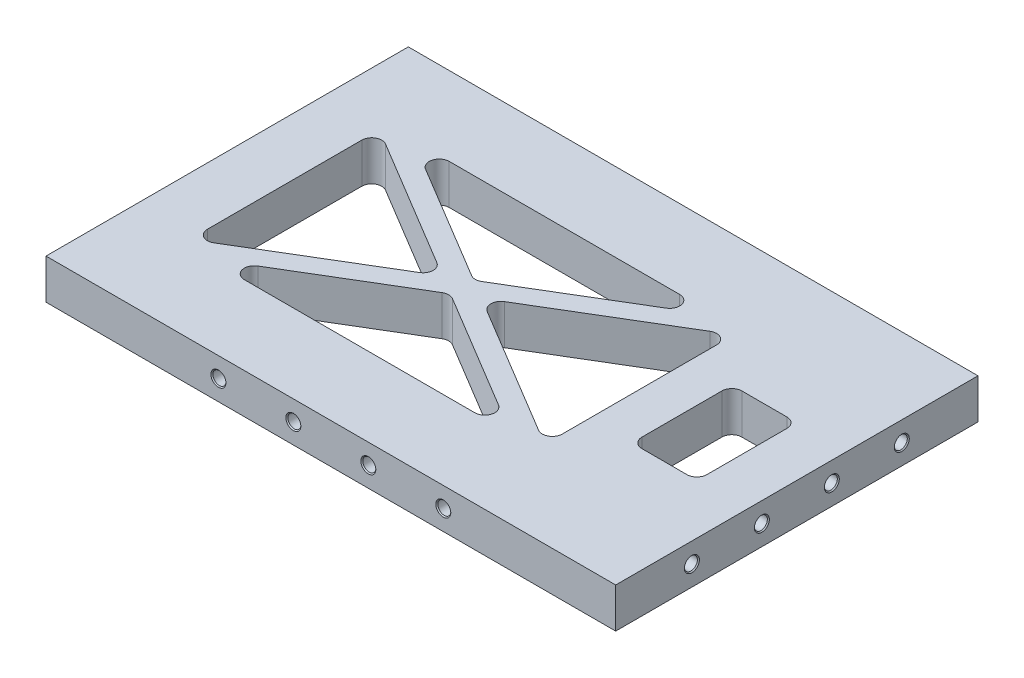
from build123d import *

# Parameters (mm, degrees)
SKETCH_1_W               = 114
SKETCH_1_H               = 72.5
EXTRUDE_1_DEPTH          = 8
SKETCH_2_R               = 1.3
CUT_EXTRUDE_1_DEPTH      = 8
PATTERN_LINEAR_1_COUNT   = 4
PATTERN_LINEAR_1_PITCH   = 15
MIRROR_1_COPY_1_SKETCH_R = 1.3
MIRROR_1_COPY_1_DEPTH    = 8
MIRROR_1_COPY_2_SKETCH_R = 1.3
MIRROR_1_COPY_2_DEPTH    = 8
MIRROR_1_COPY_3_SKETCH_R = 1.3
MIRROR_1_COPY_3_DEPTH    = 8
SKETCH_3_R               = 1.3
CUT_EXTRUDE_2_DEPTH      = 7.5
PATTERN_LINEAR_2_COUNT   = 4
PATTERN_LINEAR_2_PITCH   = 14
MIRROR_2_COPY_1_SKETCH_R = 1.3
MIRROR_2_COPY_1_DEPTH    = 7.5
MIRROR_2_COPY_2_SKETCH_R = 1.3
MIRROR_2_COPY_2_DEPTH    = 7.5
MIRROR_2_COPY_3_SKETCH_R = 1.3
MIRROR_2_COPY_3_DEPTH    = 7.5
CUT_EXTRUDE_3_REACH      = 70.023
SKETCH_4_W               = 13
SKETCH_4_H               = 20
FILLET_1_R               = 2
CHAMFER_1_SIZE           = 0.2


with BuildPart() as part:
    # 草圖1 → 填料-伸長1 (new body)
    with BuildSketch(Plane(origin=(0, 0, 0), x_dir=(1, 0, 0), z_dir=(0, 1, 0))):
        Rectangle(SKETCH_1_W, SKETCH_1_H)
    extrude(amount=EXTRUDE_1_DEPTH)

    # 草圖2 → 除料-伸長1 (cut)
    with BuildSketch(Plane.XY.offset(36.25)):
        with Locations((-22.5, 4)):
            Circle(SKETCH_2_R)
    cut_extrude_1 = extrude(amount=-CUT_EXTRUDE_1_DEPTH, mode=Mode.SUBTRACT)

    # 直線複製排列1: 除料-伸長1 ×4
    with Locations(*[(i * PATTERN_LINEAR_1_PITCH, 0, 0) for i in range(1, PATTERN_LINEAR_1_COUNT)]):
        add(cut_extrude_1, mode=Mode.SUBTRACT)

    # 鏡射1: 除料-伸長1 across plane
    add(cut_extrude_1.mirror(Plane.XY), mode=Mode.SUBTRACT)

    # 鏡射1 copy 1 sketch → 鏡射1 copy 1 (cut)
    with BuildSketch(Plane(origin=(15, 0, -36.25), x_dir=(1, 0, 0), z_dir=(0, 0, -1))):
        with Locations((-22.5, -4)):
            Circle(MIRROR_1_COPY_1_SKETCH_R)
    extrude(amount=-MIRROR_1_COPY_1_DEPTH, mode=Mode.SUBTRACT)

    # 鏡射1 copy 2 sketch → 鏡射1 copy 2 (cut)
    with BuildSketch(Plane(origin=(30, 0, -36.25), x_dir=(1, 0, 0), z_dir=(0, 0, -1))):
        with Locations((-22.5, -4)):
            Circle(MIRROR_1_COPY_2_SKETCH_R)
    extrude(amount=-MIRROR_1_COPY_2_DEPTH, mode=Mode.SUBTRACT)

    # 鏡射1 copy 3 sketch → 鏡射1 copy 3 (cut)
    with BuildSketch(Plane(origin=(45, 0, -36.25), x_dir=(1, 0, 0), z_dir=(0, 0, -1))):
        with Locations((-22.5, -4)):
            Circle(MIRROR_1_COPY_3_SKETCH_R)
    extrude(amount=-MIRROR_1_COPY_3_DEPTH, mode=Mode.SUBTRACT)

    # 草圖3 → 除料-伸長2 (cut)
    with BuildSketch(Plane.ZY.offset(57)):
        with Locations((-21, 4)):
            Circle(SKETCH_3_R)
    cut_extrude_2 = extrude(amount=-CUT_EXTRUDE_2_DEPTH, mode=Mode.SUBTRACT)

    # 直線複製排列2: 除料-伸長2 ×4
    with Locations(*[(0, 0, i * PATTERN_LINEAR_2_PITCH) for i in range(1, PATTERN_LINEAR_2_COUNT)]):
        add(cut_extrude_2, mode=Mode.SUBTRACT)

    # 鏡射2: 除料-伸長2 across plane
    add(cut_extrude_2.mirror(Plane(origin=(0, 0, 0), x_dir=(0, 0, 1), z_dir=(1, 0, 0))), mode=Mode.SUBTRACT)

    # 鏡射2 copy 1 sketch → 鏡射2 copy 1 (cut)
    with BuildSketch(Plane(origin=(57, 0, 14), x_dir=(0, 0, 1), z_dir=(1, 0, 0))):
        with Locations((-21, -4)):
            Circle(MIRROR_2_COPY_1_SKETCH_R)
    extrude(amount=-MIRROR_2_COPY_1_DEPTH, mode=Mode.SUBTRACT)

    # 鏡射2 copy 2 sketch → 鏡射2 copy 2 (cut)
    with BuildSketch(Plane(origin=(57, 0, 28), x_dir=(0, 0, 1), z_dir=(1, 0, 0))):
        with Locations((-21, -4)):
            Circle(MIRROR_2_COPY_2_SKETCH_R)
    extrude(amount=-MIRROR_2_COPY_2_DEPTH, mode=Mode.SUBTRACT)

    # 鏡射2 copy 3 sketch → 鏡射2 copy 3 (cut)
    with BuildSketch(Plane(origin=(57, 0, 42), x_dir=(0, 0, 1), z_dir=(1, 0, 0))):
        with Locations((-21, -4)):
            Circle(MIRROR_2_COPY_3_SKETCH_R)
    extrude(amount=-MIRROR_2_COPY_3_DEPTH, mode=Mode.SUBTRACT)

    # 草圖4 → 除料-伸長3 (cut, up to next)
    with BuildSketch(Plane(origin=(0, 8, 0), x_dir=(1, 0, 0), z_dir=(0, 1, 0)), mode=Mode.PRIVATE) as cut_extrude_3_sk1:
        Polygon((-45.5, 18.967619242), (-45.5, -18.967619242), (-13.887301263, 0), align=None)
    cut_extrude_3_tool1 = extrude(cut_extrude_3_sk1.sketch, amount=-CUT_EXTRUDE_3_REACH, mode=Mode.PRIVATE) & part.part
    # 草圖4 → 除料-伸長3 (cut, up to next)
    with BuildSketch(Plane(origin=(0, 8, 0), x_dir=(1, 0, 0), z_dir=(0, 1, 0)), mode=Mode.PRIVATE) as cut_extrude_3_sk2:
        Polygon((-40.279365403, 20.5), (-10, 2.332380758), (20.279365403, 20.5), align=None)
    cut_extrude_3_tool2 = extrude(cut_extrude_3_sk2.sketch, amount=-CUT_EXTRUDE_3_REACH, mode=Mode.PRIVATE) & part.part
    # 草圖4 → 除料-伸長3 (cut, up to next)
    with BuildSketch(Plane(origin=(0, 8, 0), x_dir=(1, 0, 0), z_dir=(0, 1, 0)), mode=Mode.PRIVATE) as cut_extrude_3_sk3:
        Polygon((-6.112698737, 0), (25.5, 18.967619242), (25.5, -18.967619242), align=None)
    cut_extrude_3_tool3 = extrude(cut_extrude_3_sk3.sketch, amount=-CUT_EXTRUDE_3_REACH, mode=Mode.PRIVATE) & part.part
    # 草圖4 → 除料-伸長3 (cut, up to next)
    with BuildSketch(Plane(origin=(0, 8, 0), x_dir=(1, 0, 0), z_dir=(0, 1, 0)), mode=Mode.PRIVATE) as cut_extrude_3_sk4:
        Polygon((-10, -2.332380758), (20.279365403, -20.5), (-40.279365403, -20.5), align=None)
    cut_extrude_3_tool4 = extrude(cut_extrude_3_sk4.sketch, amount=-CUT_EXTRUDE_3_REACH, mode=Mode.PRIVATE) & part.part
    # 草圖4 → 除料-伸長3 (cut, up to next)
    with BuildSketch(Plane(origin=(0, 8, 0), x_dir=(1, 0, 0), z_dir=(0, 1, 0)), mode=Mode.PRIVATE) as cut_extrude_3_sk5:
        with Locations((40.5, 0)):
            Rectangle(SKETCH_4_W, SKETCH_4_H)
    cut_extrude_3_tool5 = extrude(cut_extrude_3_sk5.sketch, amount=-CUT_EXTRUDE_3_REACH, mode=Mode.PRIVATE) & part.part
    add(cut_extrude_3_tool1.solids().sort_by_distance((-34.962434, 8, 0))[0], mode=Mode.SUBTRACT)
    add(cut_extrude_3_tool2.solids().sort_by_distance((-10, 8, -14.444127))[0], mode=Mode.SUBTRACT)
    add(cut_extrude_3_tool3.solids().sort_by_distance((14.962434, 8, 0))[0], mode=Mode.SUBTRACT)
    add(cut_extrude_3_tool4.solids().sort_by_distance((-10, 8, 14.444127))[0], mode=Mode.SUBTRACT)
    add(cut_extrude_3_tool5.solids().sort_by_distance((40.5, 8, 0))[0], mode=Mode.SUBTRACT)

    # 圓角1
    fillet_1_edges = [part.edges().sort_by_distance(p)[0] for p in [
        (-45.5, 4, 18.967619242),
        (-45.5, 4, -18.967619242),
        (-13.887301263, 4, 0),
        (-6.112698737, 4, 0),
        (25.5, 4, -18.967619242),
        (25.5, 4, 18.967619242),
        (-10, 4, -2.332380758),
        (-40.279365403, 4, -20.5),
        (20.279365403, 4, -20.5),
        (-10, 4, 2.332380758),
        (20.279365403, 4, 20.5),
        (-40.279365403, 4, 20.5),
        (47, 4, -10),
        (47, 4, 10),
        (34, 4, 10),
        (34, 4, -10),
    ]]
    fillet(fillet_1_edges, radius=FILLET_1_R)

    # 導角1
    chamfer_1_edges = [part.edges().sort_by_distance(p)[0] for p in [
        (-23.8, 4, 36.25),
        (-8.8, 4, 36.25),
        (6.2, 4, 36.25),
        (21.2, 4, 36.25),
        (-23.8, 4, -36.25),
        (-8.8, 4, -36.25),
        (6.2, 4, -36.25),
        (21.2, 4, -36.25),
        (-57, 4, -22.3),
        (-57, 4, -8.3),
        (-57, 4, 5.7),
        (-57, 4, 19.7),
        (57, 4, -22.3),
        (57, 4, -8.3),
        (57, 4, 5.7),
        (57, 4, 19.7),
    ]]
    chamfer(chamfer_1_edges, length=CHAMFER_1_SIZE)


solid = part.part
